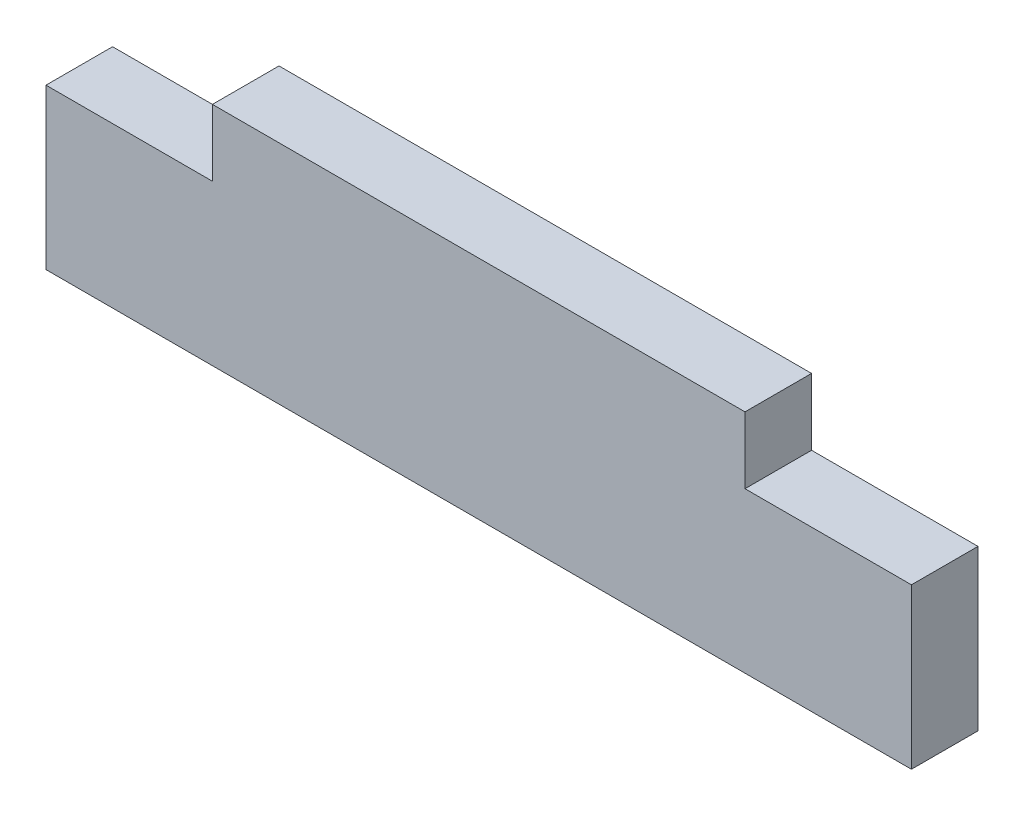
from build123d import *

# Parameters (mm, degrees)
AUFSATZ_LINEAR_AUSTRAGEN1_DEPTH = 5


with BuildPart() as part:
    # Skizze1 → Aufsatz-Linear austragen1 (new body)
    with BuildSketch(Plane.XY):
        Polygon((20, 17), (-20, 17), (-20, 12), (-32.5, 12), (-32.5, 0), (32.5, 0), (32.5, 12), (20, 12), align=None)
    extrude(amount=AUFSATZ_LINEAR_AUSTRAGEN1_DEPTH)


solid = part.part
